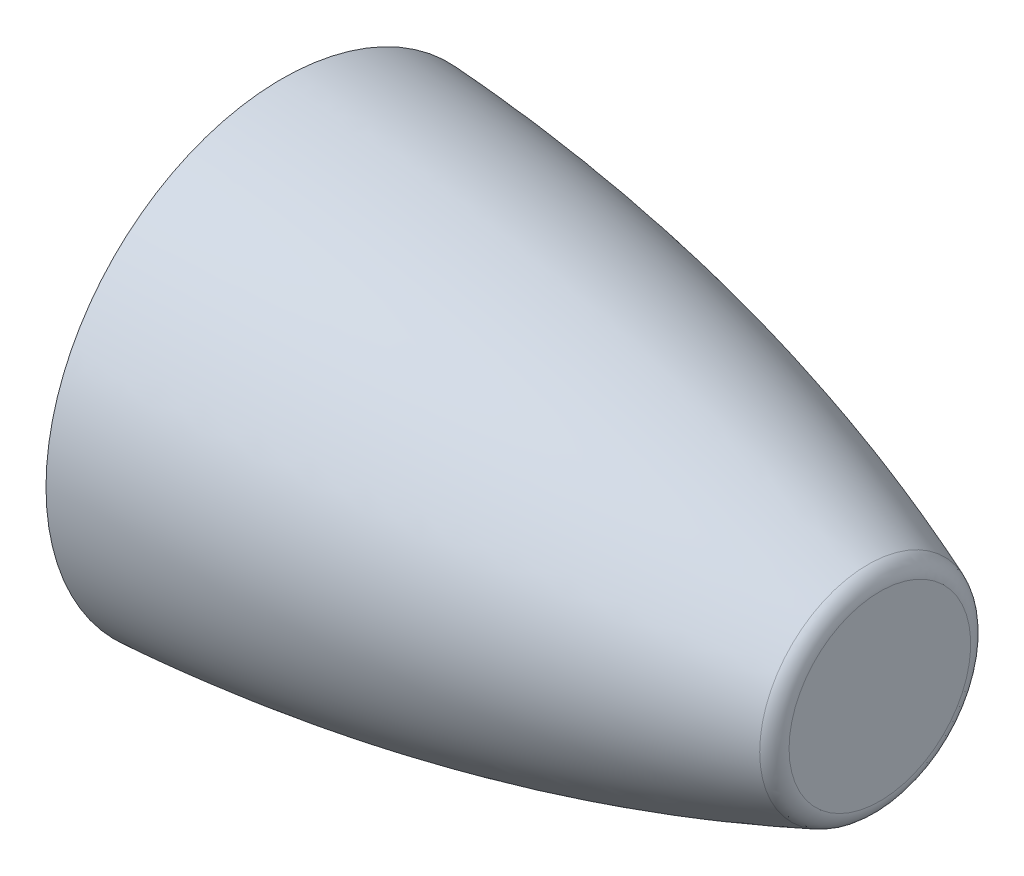
from build123d import *


with BuildPart() as part:
    # Esboço1 → Revolução1 (revolve)
    with BuildSketch(Plane(origin=(0, 0, 0), x_dir=(-1, 0, 0), z_dir=(0, 0, -1)), mode=Mode.PRIVATE) as revolu_o1_sk:
        with BuildLine():
            Line((-15.875, 2.410215906), (-15.875, 0))
            Line((-15.875, 0), (-12.7, 0))
            Line((-12.7, 0), (-12.7, 1.5875))
            Line((-12.7, 1.5875), (-1.7e-08, 1.5875))
            Line((-1.7e-08, 1.5875), (-1.7e-08, 6.256455548))
            add(Edge.make_bspline(
                [(-1.7e-08, 6.256455548), (-4.609079606, 5.984390164), (-10.013903274, 5.084359418), (-15.560059016, 2.874708285)],
                knots=[0, 0, 0, 0, 1, 1, 1, 1], degree=3))
            add(Edge.make_bspline(
                [(-15.875, 2.410215906), (-15.875000006, 2.597281252), (-15.733839869, 2.80547203), (-15.560059016, 2.874708285)],
                knots=[0, 0, 0, 0, 1, 1, 1, 1], degree=3))
        make_face()
    revolve(revolu_o1_sk.sketch.rotate(Axis((15.880000012, 0, 0), (-1, 0, 0)), 270), axis=Axis((15.880000012, 0, 0), (-1, 0, 0)))


solid = part.part
